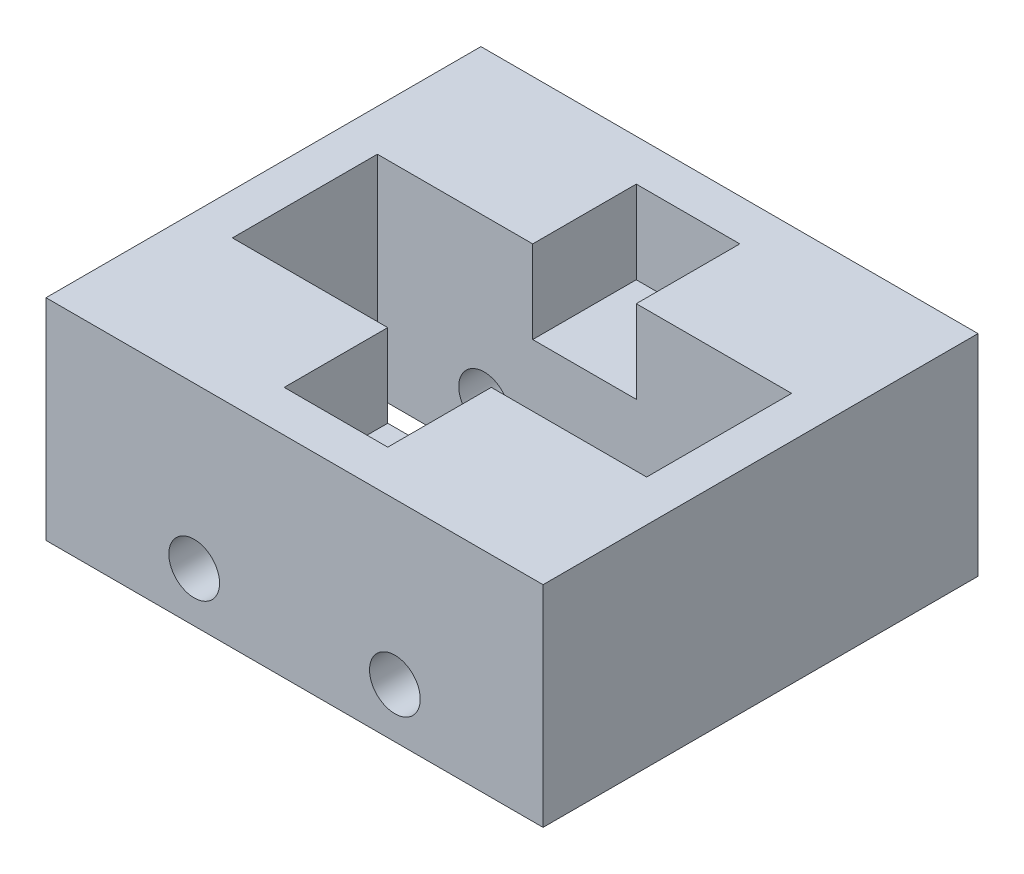
from build123d import *

# Parameters (mm, degrees)
ESQUISSE2_R        = 1.225
BOSS_EXTRU_1_DEPTH = 7
ESQUISSE3_W        = 5
ESQUISSE3_H        = 4
BOSS_EXTRU_2_DEPTH = 2
ESQUISSE5_W        = 2
ESQUISSE5_H        = 10.15
BOSS_EXTRU_3_DEPTH = 7


with BuildPart() as part:
    # Esquisse2 → Boss.-Extru.1 (new body)
    with BuildSketch(Plane.XY):
        Polygon((12, 5.075), (2.5, 5.075), (2.5, 1.075), (-2.5, 1.075), (-2.5, 5.075), (-12, 5.075), (-12, -5.075), (12, -5.075), align=None)
        with Locations((4.845, -2.675)):
            Circle(ESQUISSE2_R, mode=Mode.SUBTRACT)
        with Locations((-4.845, -2.675)):
            Circle(ESQUISSE2_R, mode=Mode.SUBTRACT)
    extrude(amount=BOSS_EXTRU_1_DEPTH)

    # Esquisse3 → Boss.-Extru.2 (add)
    with BuildSketch(Plane.XY.offset(7)):
        with Locations((0, 3.075)):
            Rectangle(ESQUISSE3_W, ESQUISSE3_H)
    extrude(amount=-BOSS_EXTRU_2_DEPTH)

    # Esquisse5 → Boss.-Extru.3 (add)
    with BuildSketch(Plane(origin=(0, 0, 0), x_dir=(-1, 0, 0), z_dir=(0, 0, -1))):
        with Locations((-11, 0)):
            Rectangle(ESQUISSE5_W, ESQUISSE5_H)
        with Locations((11, 0)):
            Rectangle(ESQUISSE5_W, ESQUISSE5_H)
    extrude(amount=BOSS_EXTRU_3_DEPTH)

    # Symétrie1: part across plane


with BuildPart() as part_1:
    add(part.part)
    add(part.part.mirror(Plane(origin=(0, 0, -3.5), x_dir=(1, 0, 0), z_dir=(0, 0, -1))))


solid = part_1.part
